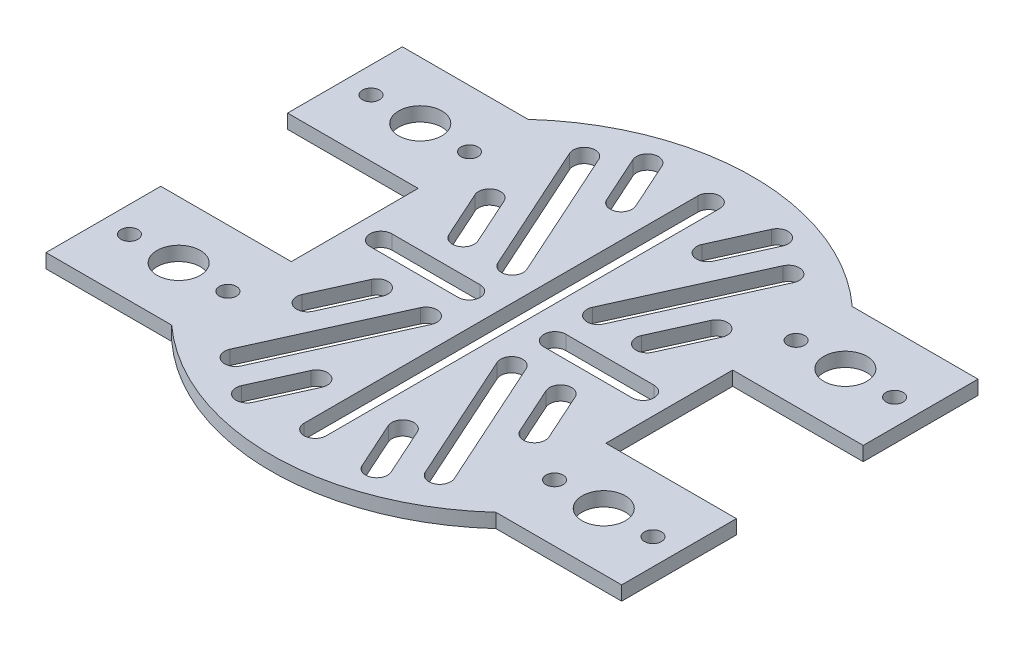
from build123d import *

# Parameters (mm, degrees)
BOSS_EXTRUDE1_DEPTH = 1
SKETCH3_R           = 1.2
SKETCH3_R_2         = 3.05
CUT_EXTRUDE1_DEPTH  = 54.01311748


with BuildPart() as part:
    # Sketch1 → Boss-Extrude1 (new, symmetric)
    with BuildSketch(Plane(origin=(0, 0, 0), x_dir=(1, 0, 0), z_dir=(0, 1, 0))):
        with BuildLine():
            Line((22.2, 8.95), (22.2, -8.95))
            Line((22.2, -8.95), (40.625, -8.95))
            Line((40.625, -8.95), (40.625, -25.15))
            Line((40.625, -25.15), (22.879630679, -25.15))
            ThreePointArc((22.879630679, -25.15), (0, -34), (-22.879630679, -25.15))
            Line((-22.879630679, -25.15), (-40.625, -25.15))
            Line((-40.625, -25.15), (-40.625, -8.95))
            Line((-40.625, -8.95), (-22.2, -8.95))
            Line((-22.2, -8.95), (-22.2, 8.95))
            Line((-22.2, 8.95), (-40.625, 8.95))
            Line((-40.625, 8.95), (-40.625, 25.15))
            Line((-40.625, 25.15), (-22.879630679, 25.15))
            ThreePointArc((-22.879630679, 25.15), (0, 34), (22.879630679, 25.15))
            Line((22.879630679, 25.15), (40.625, 25.15))
            Line((40.625, 25.15), (40.625, 8.95))
            Line((40.625, 8.95), (22.2, 8.95))
        make_face()
    extrude(amount=BOSS_EXTRUDE1_DEPTH, both=True)

    # Sketch3 → Cut-Extrude1 (cut, through all)
    with BuildSketch(Plane(origin=(0, 1, 0), x_dir=(1, 0, 0), z_dir=(0, 1, 0))):
        with Locations(Location((-36.95, 17.05, 0), (0, 0, 270))):
            Circle(SKETCH3_R)
        with Locations(Location((-30, 17.05, 0), (0, 0, 270))):
            Circle(SKETCH3_R_2)
        with Locations(Location((-23.05, 17.05, 0), (0, 0, 270))):
            Circle(SKETCH3_R)
        with Locations(Location((23.05, 17.05, 0), (0, 0, 90))):
            Circle(SKETCH3_R)
        with Locations(Location((30, 17.05, 0), (0, 0, 90))):
            Circle(SKETCH3_R_2)
        with Locations(Location((36.95, 17.05, 0), (0, 0, 90))):
            Circle(SKETCH3_R)
        with Locations(Location((36.95, -17.05, 0), (0, 0, 270))):
            Circle(SKETCH3_R)
        with Locations(Location((30, -17.05, 0), (0, 0, 270))):
            Circle(SKETCH3_R_2)
        with Locations(Location((23.05, -17.05, 0), (0, 0, 270))):
            Circle(SKETCH3_R)
        with Locations(Location((-23.05, -17.05, 0), (0, 0, 90))):
            Circle(SKETCH3_R)
        with Locations(Location((-30, -17.05, 0), (0, 0, 90))):
            Circle(SKETCH3_R_2)
        with Locations(Location((-36.95, -17.05, 0), (0, 0, 90))):
            Circle(SKETCH3_R)
        with BuildLine():
            Line((1.55, 27.775), (1.55, -27.775))
            ThreePointArc((1.55, -27.775), (0, -29.325), (-1.55, -27.775))
            Line((-1.55, -27.775), (-1.55, 27.775))
            ThreePointArc((-1.55, 27.775), (0, 29.325), (1.55, 27.775))
        make_face()
        with BuildLine():
            Line((-18.5, 1.55), (-6.05, 1.55))
            ThreePointArc((-6.05, 1.55), (-4.5, 0), (-6.05, -1.55))
            Line((-6.05, -1.55), (-18.5, -1.55))
            ThreePointArc((-18.5, -1.55), (-20.05, 0), (-18.5, 1.55))
        make_face()
        with BuildLine():
            Line((6.05, 1.55), (18.5, 1.55))
            ThreePointArc((18.5, 1.55), (20.05, 0), (18.5, -1.55))
            Line((18.5, -1.55), (6.05, -1.55))
            ThreePointArc((6.05, -1.55), (4.5, 0), (6.05, 1.55))
        make_face()
        with BuildLine():
            Line((4.637438424, 6.738098576), (12.99447139, 25.238098576))
            ThreePointArc((12.99447139, 25.238098576), (15.045131543, 26.012561576), (15.819594543, 23.961901424))
            Line((15.819594543, 23.961901424), (7.462561576, 5.461901424))
            ThreePointArc((7.462561576, 5.461901424), (5.411901424, 4.687438424), (4.637438424, 6.738098576))
        make_face()
        with BuildLine():
            Line((4.687438424, 22.152061943), (7.73384453, 28.895904308))
            ThreePointArc((7.73384453, 28.895904308), (9.784504682, 29.670367308), (10.558967682, 27.619707155))
            Line((10.558967682, 27.619707155), (7.512561576, 20.875864791))
            ThreePointArc((7.512561576, 20.875864791), (5.461901424, 20.101401791), (4.687438424, 22.152061943))
        make_face()
        with BuildLine():
            Line((11.550411397, 6.738098576), (14.596817503, 13.481940941))
            ThreePointArc((14.596817503, 13.481940941), (16.647477655, 14.256403941), (17.421940655, 12.205743788))
            Line((17.421940655, 12.205743788), (14.375534549, 5.461901424))
            ThreePointArc((14.375534549, 5.461901424), (12.324874397, 4.687438424), (11.550411397, 6.738098576))
        make_face()
        with BuildLine():
            Line((-4.637438424, 6.738098576), (-12.99447139, 25.238098576))
            ThreePointArc((-12.99447139, 25.238098576), (-15.045131543, 26.012561576), (-15.819594543, 23.961901424))
            Line((-15.819594543, 23.961901424), (-7.462561576, 5.461901424))
            ThreePointArc((-7.462561576, 5.461901424), (-5.411901424, 4.687438424), (-4.637438424, 6.738098576))
        make_face()
        with BuildLine():
            Line((-4.687438424, 22.152061943), (-7.73384453, 28.895904308))
            ThreePointArc((-7.73384453, 28.895904308), (-9.784504682, 29.670367308), (-10.558967682, 27.619707155))
            Line((-10.558967682, 27.619707155), (-7.512561576, 20.875864791))
            ThreePointArc((-7.512561576, 20.875864791), (-5.461901424, 20.101401791), (-4.687438424, 22.152061943))
        make_face()
        with BuildLine():
            Line((-11.550411397, 6.738098576), (-14.596817503, 13.481940941))
            ThreePointArc((-14.596817503, 13.481940941), (-16.647477655, 14.256403941), (-17.421940655, 12.205743788))
            Line((-17.421940655, 12.205743788), (-14.375534549, 5.461901424))
            ThreePointArc((-14.375534549, 5.461901424), (-12.324874397, 4.687438424), (-11.550411397, 6.738098576))
        make_face()
        with BuildLine():
            Line((-4.637438424, -6.738098576), (-12.99447139, -25.238098576))
            ThreePointArc((-12.99447139, -25.238098576), (-15.045131543, -26.012561576), (-15.819594543, -23.961901424))
            Line((-15.819594543, -23.961901424), (-7.462561576, -5.461901424))
            ThreePointArc((-7.462561576, -5.461901424), (-5.411901424, -4.687438424), (-4.637438424, -6.738098576))
        make_face()
        with BuildLine():
            Line((-4.687438424, -22.152061943), (-7.73384453, -28.895904308))
            ThreePointArc((-7.73384453, -28.895904308), (-9.784504682, -29.670367308), (-10.558967682, -27.619707155))
            Line((-10.558967682, -27.619707155), (-7.512561576, -20.875864791))
            ThreePointArc((-7.512561576, -20.875864791), (-5.461901424, -20.101401791), (-4.687438424, -22.152061943))
        make_face()
        with BuildLine():
            Line((-11.550411397, -6.738098576), (-14.596817503, -13.481940941))
            ThreePointArc((-14.596817503, -13.481940941), (-16.647477655, -14.256403941), (-17.421940655, -12.205743788))
            Line((-17.421940655, -12.205743788), (-14.375534549, -5.461901424))
            ThreePointArc((-14.375534549, -5.461901424), (-12.324874397, -4.687438424), (-11.550411397, -6.738098576))
        make_face()
        with BuildLine():
            Line((4.637438424, -6.738098576), (12.99447139, -25.238098576))
            ThreePointArc((12.99447139, -25.238098576), (15.045131543, -26.012561576), (15.819594543, -23.961901424))
            Line((15.819594543, -23.961901424), (7.462561576, -5.461901424))
            ThreePointArc((7.462561576, -5.461901424), (5.411901424, -4.687438424), (4.637438424, -6.738098576))
        make_face()
        with BuildLine():
            Line((4.687438424, -22.152061943), (7.73384453, -28.895904308))
            ThreePointArc((7.73384453, -28.895904308), (9.784504682, -29.670367308), (10.558967682, -27.619707155))
            Line((10.558967682, -27.619707155), (7.512561576, -20.875864791))
            ThreePointArc((7.512561576, -20.875864791), (5.461901424, -20.101401791), (4.687438424, -22.152061943))
        make_face()
        with BuildLine():
            Line((11.550411397, -6.738098576), (14.596817503, -13.481940941))
            ThreePointArc((14.596817503, -13.481940941), (16.647477655, -14.256403941), (17.421940655, -12.205743788))
            Line((17.421940655, -12.205743788), (14.375534549, -5.461901424))
            ThreePointArc((14.375534549, -5.461901424), (12.324874397, -4.687438424), (11.550411397, -6.738098576))
        make_face()
    extrude(amount=-CUT_EXTRUDE1_DEPTH, mode=Mode.SUBTRACT)


solid = part.part
